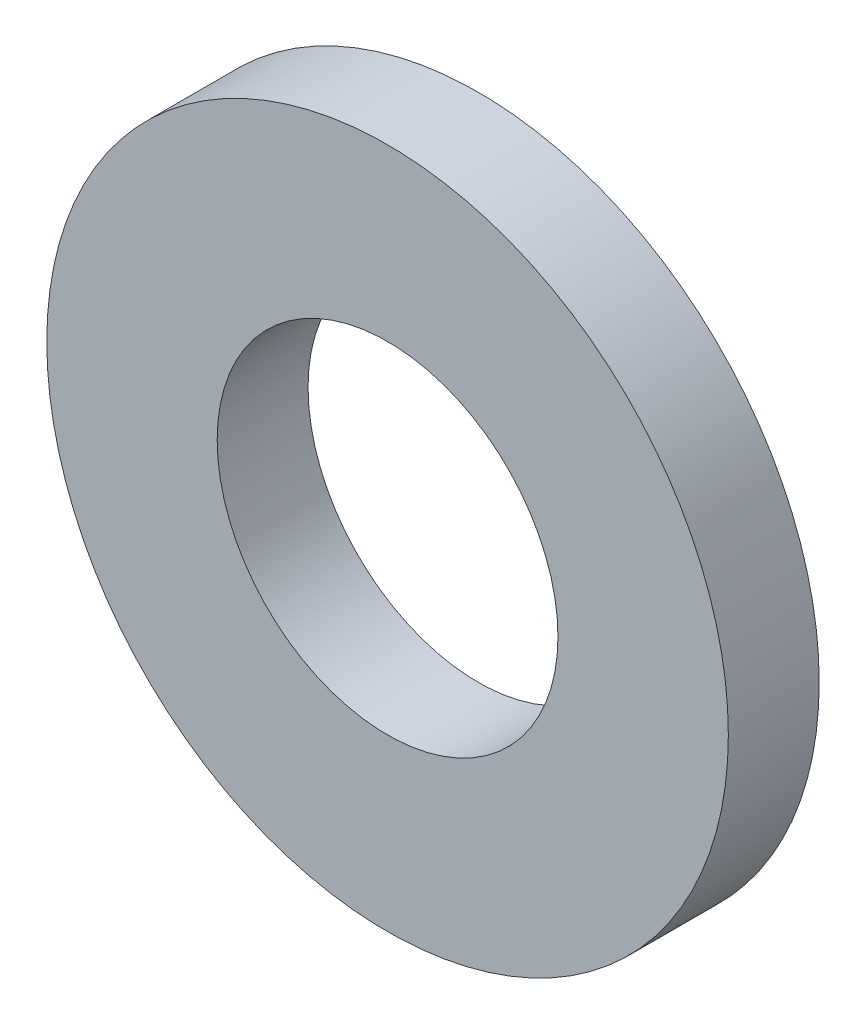
from build123d import *

# Parameters (mm, degrees)
ESQUISSE1_R      = 3
ESQUISSE1_R_2    = 1.5
EXTRUSION1_DEPTH = 0.8


with BuildPart() as part:
    # Esquisse1 → Extrusion1 (new body)
    with BuildSketch(Plane.XY):
        Circle(ESQUISSE1_R)
        Circle(ESQUISSE1_R_2, mode=Mode.SUBTRACT)
    extrude(amount=EXTRUSION1_DEPTH)


solid = part.part
